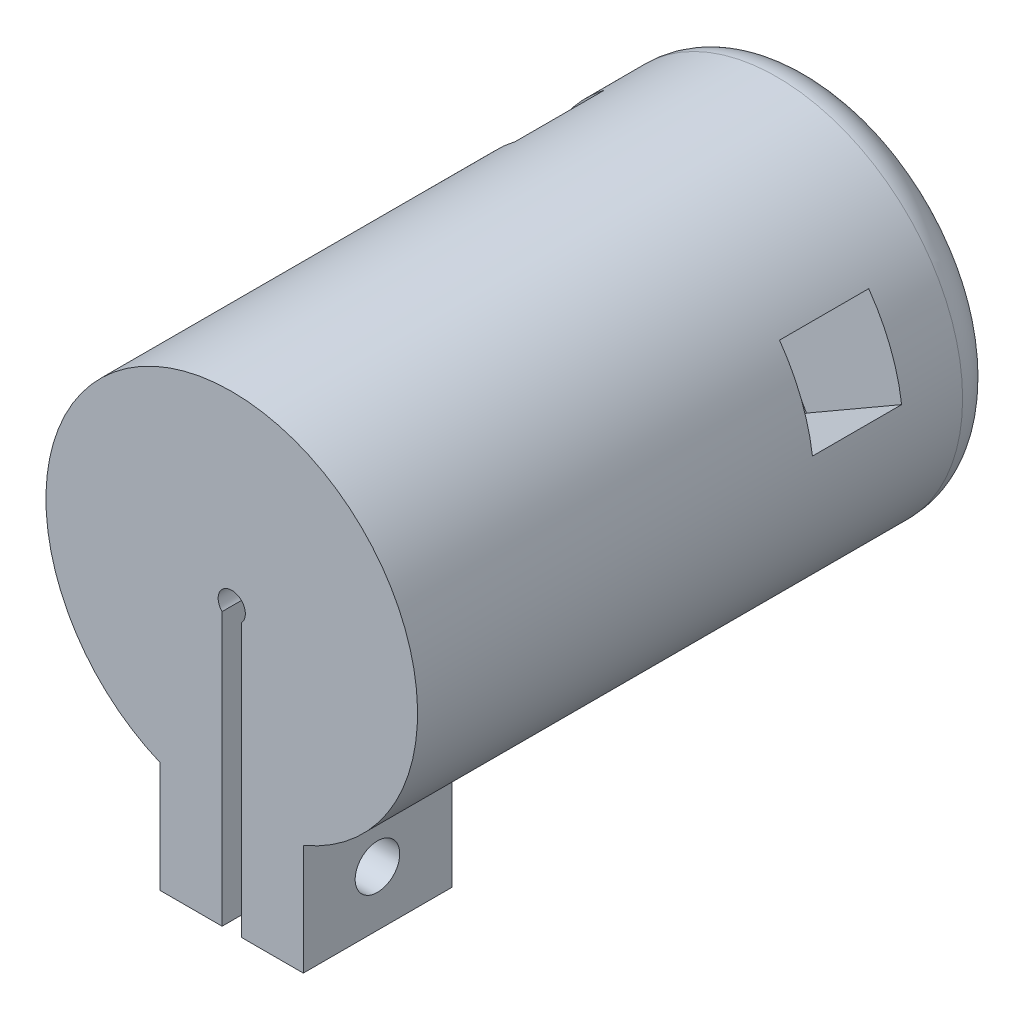
from build123d import *

# Parameters (mm, degrees)
BOSS_EXTRUDE1_DEPTH                             = 12
BOSS_EXTRUDE2_START                             = -35
SKETCH1_4_R                                     = 15
BOSS_EXTRUDE2_DEPTH                             = 35
SKETCH4_W                                       = 7.2
SKETCH4_H                                       = 7.2
CUT_EXTRUDE1_DEPTH                              = 10
CIRPATTERN1_COUNT                               = 3
FILLET1_R                                       = 3
CSK_FOR_M3_OVAL_HEAD_MACHINE_SCREW1_D           = 3.6
CSK_FOR_M3_OVAL_HEAD_MACHINE_SCREW1_CSINK_D     = 6.3
CSK_FOR_M3_OVAL_HEAD_MACHINE_SCREW1_CSINK_ANGLE = 90


with BuildPart() as part:
    # Sketch1 → Boss-Extrude1 (new body)
    with BuildSketch(Plane.XY):
        with BuildLine():
            Line((-5.777817459, -22.777817459), (-0.777817459, -22.777817459))
            Line((-0.777817459, -22.777817459), (-0.777817459, -0.777817459))
            ThreePointArc((-0.777817459, -0.777817459), (0, 1.1), (0.777817459, -0.777817459))
            Line((0.777817459, -0.777817459), (0.777817459, -22.777817459))
            Line((0.777817459, -22.777817459), (5.777817459, -22.777817459))
            Line((5.777817459, -22.777817459), (5.777817459, -13.842572933))
            ThreePointArc((5.777817459, -13.842572933), (0, 15), (-5.777817459, -13.842572933))
            Line((-5.777817459, -13.842572933), (-5.777817459, -22.777817459))
        make_face()
    extrude(amount=BOSS_EXTRUDE1_DEPTH)

    # Sketch1<4> → Boss-Extrude2 (add)
    with BuildSketch(Plane.XY.offset(BOSS_EXTRUDE2_START)):
        Circle(SKETCH1_4_R)
    extrude(amount=BOSS_EXTRUDE2_DEPTH)

    # Sketch4 → Cut-Extrude1 (cut, symmetric)
    with BuildSketch(Plane(origin=(0, -14.979819759, 0), x_dir=(-1, 0, 0), z_dir=(0, -1, 0))):
        with Locations((2.177817459, 23.6)):
            Rectangle(SKETCH4_W, SKETCH4_H)
    cut_extrude1 = extrude(amount=CUT_EXTRUDE1_DEPTH, both=True, mode=Mode.SUBTRACT)

    # CirPattern1: Cut-Extrude1 ×3 about axis
    cirpattern1_axis = Axis((0, 0, 12), (0, 0, -1))
    for i in range(1, CIRPATTERN1_COUNT):
        add(cut_extrude1.rotate(cirpattern1_axis, i * 360 / CIRPATTERN1_COUNT), mode=Mode.SUBTRACT)

    # Fillet1
    fillet1_edges = [part.edges().sort_by_distance(p)[0] for p in [
        (-15, 0, -35),
    ]]
    fillet(fillet1_edges, radius=FILLET1_R)

    # CSK for M3 Oval Head Machine Screw1 (through all)
    with Locations(Plane.ZY.offset(5.777817459)):
        with Locations((6.016146397, -18.321749647)):
            CounterSinkHole(CSK_FOR_M3_OVAL_HEAD_MACHINE_SCREW1_D / 2, CSK_FOR_M3_OVAL_HEAD_MACHINE_SCREW1_CSINK_D / 2, counter_sink_angle=CSK_FOR_M3_OVAL_HEAD_MACHINE_SCREW1_CSINK_ANGLE)


solid = part.part
